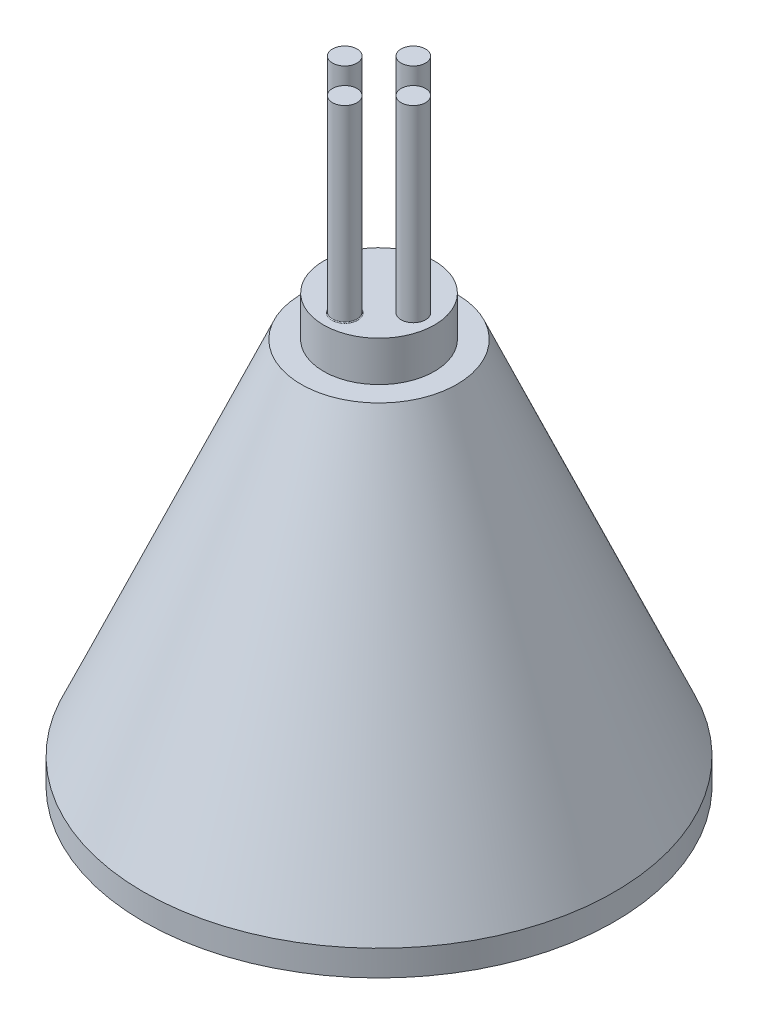
from build123d import *

# Parameters (mm, degrees)
SKETCH2_R           = 1.5
BOSS_EXTRUDE1_DEPTH = 23.04
FILLET1_R           = 0.1


with BuildPart() as part:
    # Sketch1 → Revolve1 (revolve)
    with BuildSketch(Plane(origin=(0, 0, 0), x_dir=(0, 0, -1), z_dir=(1, 0, 0))):
        Polygon((618.283966683, 10.92855784), (618.283966683, 7.778306403), (647.128456403, 7.778306403), (647.128456403, 60.052791184), (640.335726742, 60.052791184), (640.335726742, 55.130523314), (637.579256734, 55.130523314), align=None)
    revolve(axis=Axis((0, 60.052791184, -647.128456403), (0, -1, 0)))

    # Sketch2 → Boss-Extrude1 (add)
    with BuildSketch(Plane(origin=(0, 60.052791184, 0), x_dir=(1, 0, 0), z_dir=(0, 1, 0))):
        with Locations(Location((0, 651.328456403, 0), (0, 0, 90))):
            Circle(SKETCH2_R)
        with Locations(Location((-4.2, 647.128456403, 0), (0, 0, 90))):
            Circle(SKETCH2_R)
        with Locations(Location((0, 642.928456403, 0), (0, 0, 90))):
            Circle(SKETCH2_R)
        with Locations(Location((4.2, 647.128456403, 0), (0, 0, 90))):
            Circle(SKETCH2_R)
    extrude(amount=BOSS_EXTRUDE1_DEPTH)

    # Fillet1
    fillet1_edges = [part.edges().sort_by_distance(p)[0] for p in [
        (0, 60.052791184, -641.428456403),
    ]]
    fillet(fillet1_edges, radius=FILLET1_R)


solid = part.part
